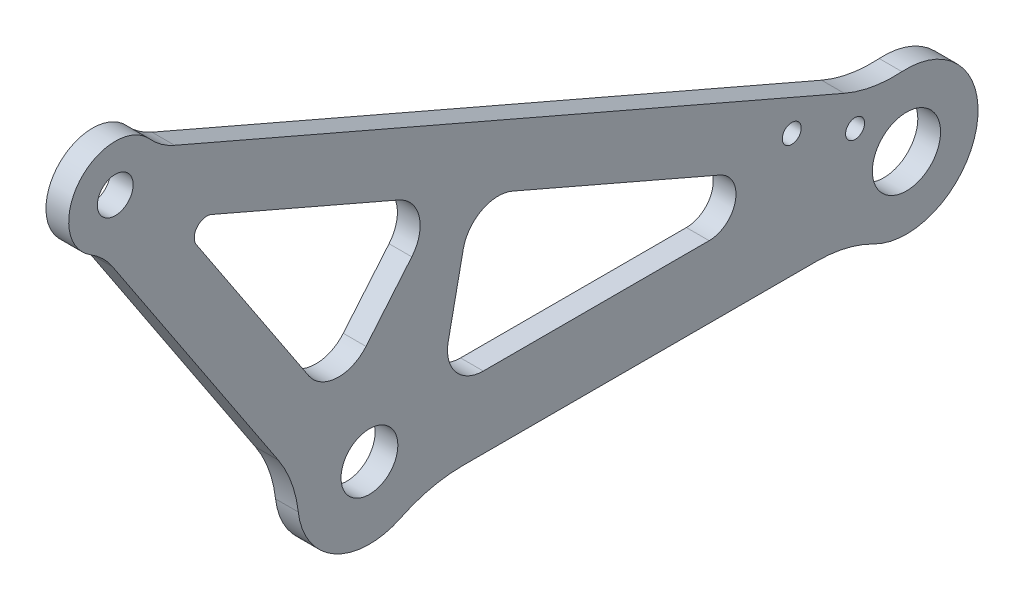
from build123d import *

# Parameters (mm, degrees)
BOSS_EXTRUDE1_DEPTH         = 6.35
F_3_4_0_75_DIAMETER_HOLE1_D = 19.05
F_10_0_10_DIAMETER_HOLE1_D  = 10
F_5_8_DIAMETER_HOLE2_D      = 15.875
CUT_EXTRUDE1_REACH          = 205.594
FILLET1_R                   = 35
FILLET3_R                   = 35
FILLET4_R                   = 20
FILLET6_R                   = 40
SKETCH22_R                  = 2.65
CUT_EXTRUDE2_DEPTH          = 10
SKETCH24_R                  = 2.65
CUT_EXTRUDE3_DEPTH          = 10


with BuildPart() as part:
    # Sketch1 → Boss-Extrude1 (new body)
    with BuildSketch(Plane(origin=(0, 0, 0), x_dir=(0, 0, -1), z_dir=(1, 0, 0))):
        with BuildLine():
            Line((-60.717143143, 0), (60.717143143, 0))
            ThreePointArc((60.717143143, 0), (94.584407895, 9.944020783), (67.452353804, 32.521151068))
            Line((67.452353804, 32.521151068), (-134.404938559, 119.878311848))
            ThreePointArc((-134.404938559, 119.878311848), (-155.966181949, 122.347168224), (-149.752887031, 101.553480851))
            Line((-149.752887031, 101.553480851), (-94.55805454, 18.181208272))
            ThreePointArc((-94.55805454, 18.181208272), (-84.465516954, -3.618285637), (-60.717143143, 0))
        make_face()
    extrude(amount=BOSS_EXTRUDE1_DEPTH)

    # 3/4 (0.75) Diameter Hole1 (through all)
    with Locations(Plane(origin=(6.35, 0, 0), x_dir=(0, 0, -1), z_dir=(1, 0, 0))):
        with Locations((75, 14)):
            Hole(F_3_4_0_75_DIAMETER_HOLE1_D / 2)

    # Ø10.0 (10) Diameter Hole1 (through all)
    with Locations(Plane(origin=(6.35, 0, 0), x_dir=(0, 0, -1), z_dir=(1, 0, 0))):
        with Locations((-146, 114)):
            Hole(F_10_0_10_DIAMETER_HOLE1_D / 2)

    # Ø5/8" Diameter Hole2 (through all)
    with Locations(Plane(origin=(6.35, 0, 0), x_dir=(0, 0, -1), z_dir=(1, 0, 0))):
        with Locations((-75, 14)):
            Hole(F_5_8_DIAMETER_HOLE2_D / 2)

    # Sketch8 → Cut-Extrude1 (cut, up to next)
    with BuildSketch(Plane(origin=(6.35, 0, 0), x_dir=(0, 0, -1), z_dir=(1, 0, 0)), mode=Mode.PRIVATE) as cut_extrude1_sk1:
        with BuildLine():
            Line((-52.98768213, 32.027989609), (-48.791838571, 52.287736349))
            ThreePointArc((-48.791838571, 52.287736349), (-43.609219792, 59.133963583), (-35.027937054, 59.43719837))
            Line((-35.027937054, 59.43719837), (22.864909862, 34.383088722))
            ThreePointArc((22.864909862, 34.383088722), (27.230289645, 25.979007794), (19.886136685, 20))
            Line((19.886136685, 20), (-43.195478183, 20))
            ThreePointArc((-43.195478183, 20), (-50.950473221, 23.686518238), (-52.98768213, 32.027989609))
        make_face()
    cut_extrude1_tool1 = extrude(cut_extrude1_sk1.sketch, amount=-CUT_EXTRUDE1_REACH, mode=Mode.PRIVATE) & part.part
    # Sketch8 → Cut-Extrude1 (cut, up to next)
    with BuildSketch(Plane(origin=(6.35, 0, 0), x_dir=(0, 0, -1), z_dir=(1, 0, 0)), mode=Mode.PRIVATE) as cut_extrude1_sk2:
        with BuildLine():
            Line((-75.95726339, 42.34340423), (-63.166421785, 57.61515284))
            ThreePointArc((-63.166421785, 57.61515284), (-61.101947711, 66.340863059), (-66.861018022, 73.213503103))
            Line((-66.861018022, 73.213503103), (-119.037006728, 95.793545572))
            ThreePointArc((-119.037006728, 95.793545572), (-123.11030371, 94.828752024), (-123.345509052, 90.649367698))
            Line((-123.345509052, 90.649367698), (-91.961866267, 43.244103424))
            ThreePointArc((-91.961866267, 43.244103424), (-84.185443207, 38.780101137), (-75.95726339, 42.34340423))
        make_face()
    cut_extrude1_tool2 = extrude(cut_extrude1_sk2.sketch, amount=-CUT_EXTRUDE1_REACH, mode=Mode.PRIVATE) & part.part
    add(cut_extrude1_tool1.solids().sort_by_distance((6.35, 35.497015, 18.727672))[0], mode=Mode.SUBTRACT)
    add(cut_extrude1_tool2.solids().sort_by_distance((6.35, 67.079595, 89.97893))[0], mode=Mode.SUBTRACT)

    # Fillet1
    fillet1_edges = [part.edges().sort_by_distance(p)[0] for p in [
        (3.175, 18.181208272, 94.55805454),
    ]]
    fillet(fillet1_edges, radius=FILLET1_R)

    # Fillet3
    fillet3_edges = [part.edges().sort_by_distance(p)[0] for p in [
        (3.175, 32.521151068, -67.452353804),
        (3.175, 0, -60.717143143),
    ]]
    fillet(fillet3_edges, radius=FILLET3_R)

    # Fillet4
    fillet4_edges = [part.edges().sort_by_distance(p)[0] for p in [
        (3.175, 101.553480851, 149.752887031),
        (3.175, 119.878311848, 134.404938559),
    ]]
    fillet(fillet4_edges, radius=FILLET4_R)

    # Fillet6
    fillet6_edges = [part.edges().sort_by_distance(p)[0] for p in [
        (3.175, 0, 60.717143143),
    ]]
    fillet(fillet6_edges, radius=FILLET6_R)

    # Sketch22 → Cut-Extrude2 (cut)
    with BuildSketch(Plane(origin=(6.35, 0, 0), x_dir=(0, 0, -1), z_dir=(1, 0, 0))):
        with Locations((60.644779113, 26.750227475)):
            Circle(SKETCH22_R)
    extrude(amount=-CUT_EXTRUDE2_DEPTH, mode=Mode.SUBTRACT)

    # Sketch24 → Cut-Extrude3 (cut)
    with BuildSketch(Plane(origin=(6.35, 0, 0), x_dir=(0, 0, -1), z_dir=(1, 0, 0))):
        with Locations((42.966527297, 34.400790246)):
            Circle(SKETCH24_R)
    extrude(amount=-CUT_EXTRUDE3_DEPTH, mode=Mode.SUBTRACT)


solid = part.part
